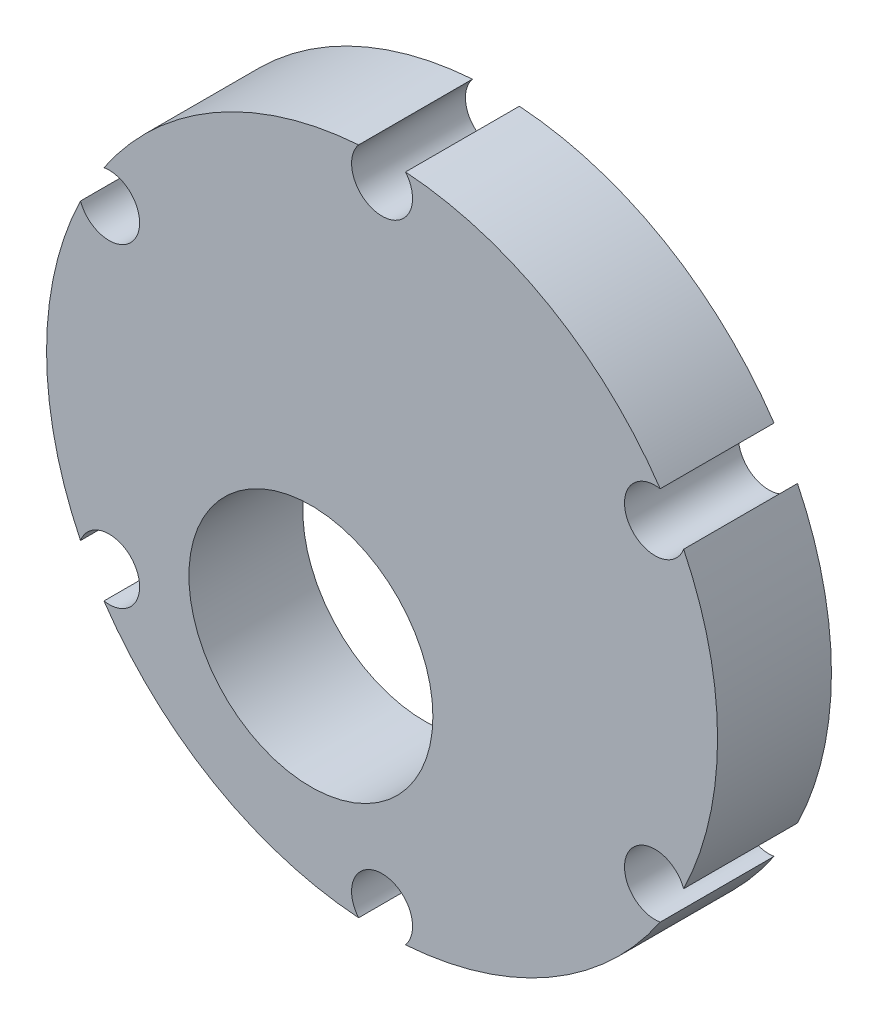
from build123d import *

# Parameters (mm, degrees)
SKETCH1_R           = 16.5
BOSS_EXTRUDE1_DEPTH = 5.6
SKETCH2_R           = 1.5
CUT_EXTRUDE1_DEPTH  = 24.997083156
SKETCH3_R           = 6
CUT_EXTRUDE2_DEPTH  = 24.969375894


with BuildPart() as part:
    # Sketch1 → Boss-Extrude1 (new body)
    with BuildSketch(Plane.XY):
        Circle(SKETCH1_R)
    extrude(amount=BOSS_EXTRUDE1_DEPTH)

    # Sketch2 → Cut-Extrude1 (cut, through all)
    with BuildSketch(Plane.XY.offset(5.6)):
        with Locations((0, 15.5)):
            Circle(SKETCH2_R)
        with Locations((13.423393759, 7.75)):
            Circle(SKETCH2_R)
        with Locations((13.423393759, -7.75)):
            Circle(SKETCH2_R)
        with Locations((0, -15.5)):
            Circle(SKETCH2_R)
        with Locations((-13.423393759, -7.75)):
            Circle(SKETCH2_R)
        with Locations((-13.423393759, 7.75)):
            Circle(SKETCH2_R)
    extrude(amount=-CUT_EXTRUDE1_DEPTH, mode=Mode.SUBTRACT)

    # Sketch3 → Cut-Extrude2 (cut, through all)
    with BuildSketch(Plane.XY.offset(5.6)):
        with Locations((-3.5, -6.062177826)):
            Circle(SKETCH3_R)
    extrude(amount=-CUT_EXTRUDE2_DEPTH, mode=Mode.SUBTRACT)


solid = part.part
